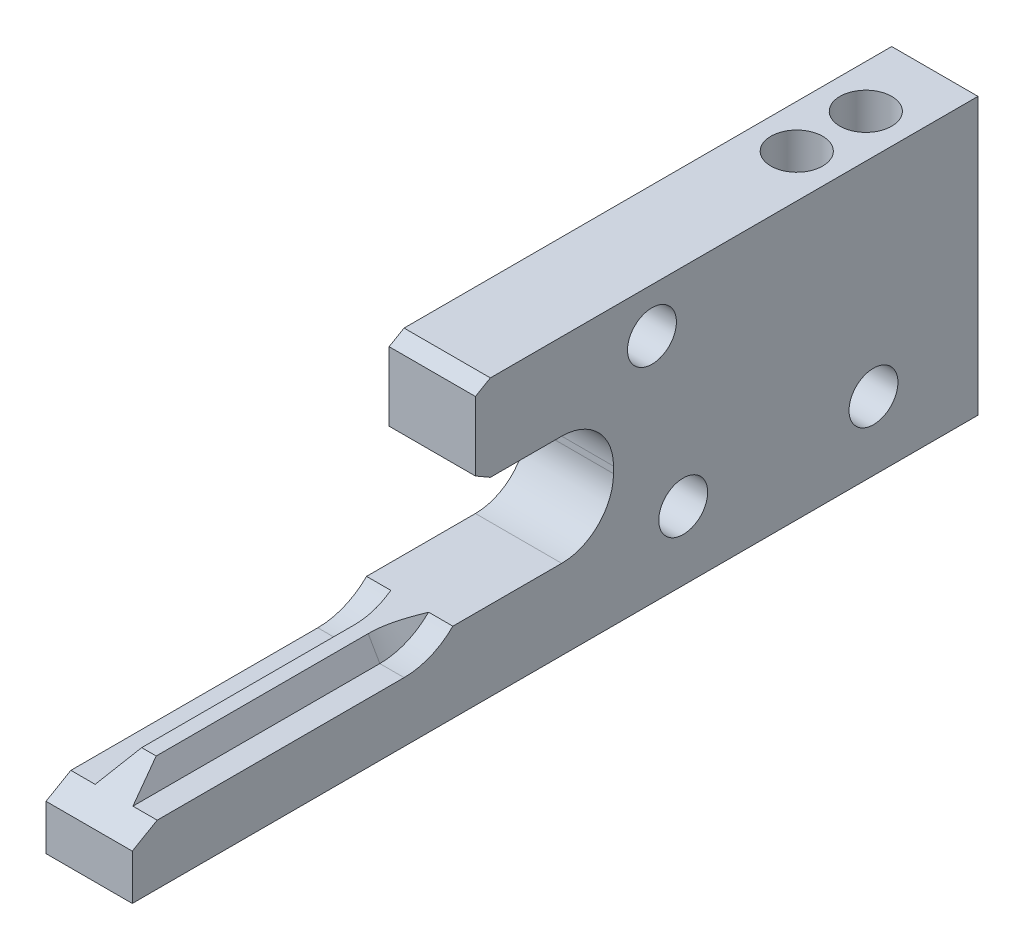
from build123d import *

# Parameters (mm, degrees)
EXTRUDE1_DEPTH                   = 15.875
EXTRUDE2_DEPTH                   = 50
F_3_8_0_375_DIAMETER_HOLE1_D     = 9.525
F_3_8_0_375_DIAMETER_HOLE1_DEPTH = 32.4000114
F_3_8_0_375_DIAMETER_HOLE1_TIP   = 1.733408241
SKETCH6_R                        = 4.5
EXTRUDE3_DEPTH                   = 165.426993678


with BuildPart() as part:
    # Sketch1 → Extrude1 (new body)
    with BuildSketch(Plane(origin=(0, 0, 0), x_dir=(0, 0, -1), z_dir=(1, 0, 0))):
        with BuildLine():
            Line((0, 0), (-155.575, 0))
            Line((-155.575, 0), (-155.575, 14.6939))
            Line((-155.575, 14.6939), (-76.581, 14.6939))
            ThreePointArc((-76.581, 14.6939), (-69.845807909, 17.483707909), (-67.056, 24.2189))
            Line((-67.056, 24.2189), (-67.056, 25.4254))
            ThreePointArc((-67.056, 25.4254), (-69.845807909, 32.160592091), (-76.581, 34.9504))
            Line((-76.581, 34.9504), (-89.706369343, 34.9504))
            Line((-89.706369343, 34.9504), (-92.456, 36.5379))
            Line((-92.456, 36.5379), (-92.456, 49.2125))
            Line((-92.456, 49.2125), (-89.706369343, 50.8))
            Line((-89.706369343, 50.8), (0, 50.8))
            Line((0, 50.8), (0, 0))
        make_face()
    extrude(amount=EXTRUDE1_DEPTH)

    # Sketch2 → Extrude2 (cut)
    with BuildSketch(Plane.XY.offset(155.575)):
        Polygon((0, 10.9855), (4.462954262, 10.9855), (6.604, 14.6939), (9.271, 14.6939), (11.412045738, 10.9855), (15.875, 10.9855), (15.875, 23.6855), (0, 23.6855), align=None)
    extrude(amount=-EXTRUDE2_DEPTH, mode=Mode.SUBTRACT)

    # Sketch3 → Cut-Revolve1 (revolve, cut)
    with BuildSketch(Plane.XY.offset(105.575)):
        Polygon((0, 10.9855), (4.462954262, 10.9855), (6.604, 14.6939), (9.271, 14.6939), (11.412045738, 10.9855), (15.875, 10.9855), (15.875, 23.6855), (0, 23.6855), align=None)
    revolve(axis=Axis((15.875, 23.6855, 105.575), (-1, 0, 0)), mode=Mode.SUBTRACT)

    # 3/8 (0.375) Diameter Hole1
    with Locations(Plane(origin=(0, 50.8, 0), x_dir=(-1, 0, 0), z_dir=(0, 1, 0))):
        with Locations((-7.9375, 25.4), (-7.9375, 12.7)):
            Hole(F_3_8_0_375_DIAMETER_HOLE1_D / 2, depth=F_3_8_0_375_DIAMETER_HOLE1_DEPTH)
            with Locations((0, 0, -(F_3_8_0_375_DIAMETER_HOLE1_DEPTH + F_3_8_0_375_DIAMETER_HOLE1_TIP / 2))):  # 140° drill point
                Cone(0, F_3_8_0_375_DIAMETER_HOLE1_D / 2, F_3_8_0_375_DIAMETER_HOLE1_TIP, mode=Mode.SUBTRACT)

    # Sketch6 → Extrude3 (cut, through all)
    with BuildSketch(Plane(origin=(15.875, 0, 0), x_dir=(0, 0, -1), z_dir=(1, 0, 0))):
        with Locations((-54.230000076, 12.609999896)):
            Circle(SKETCH6_R)
        with Locations((-19.230000076, 12.609999896)):
            Circle(SKETCH6_R)
        with Locations((-59.980000078, 42.60999987)):
            Circle(SKETCH6_R)
        Polygon((-155.575, 8.3439), (-144.576477372, 14.6939), (-155.575, 14.6939), align=None)
    extrude(amount=-EXTRUDE3_DEPTH, mode=Mode.SUBTRACT)


solid = part.part
